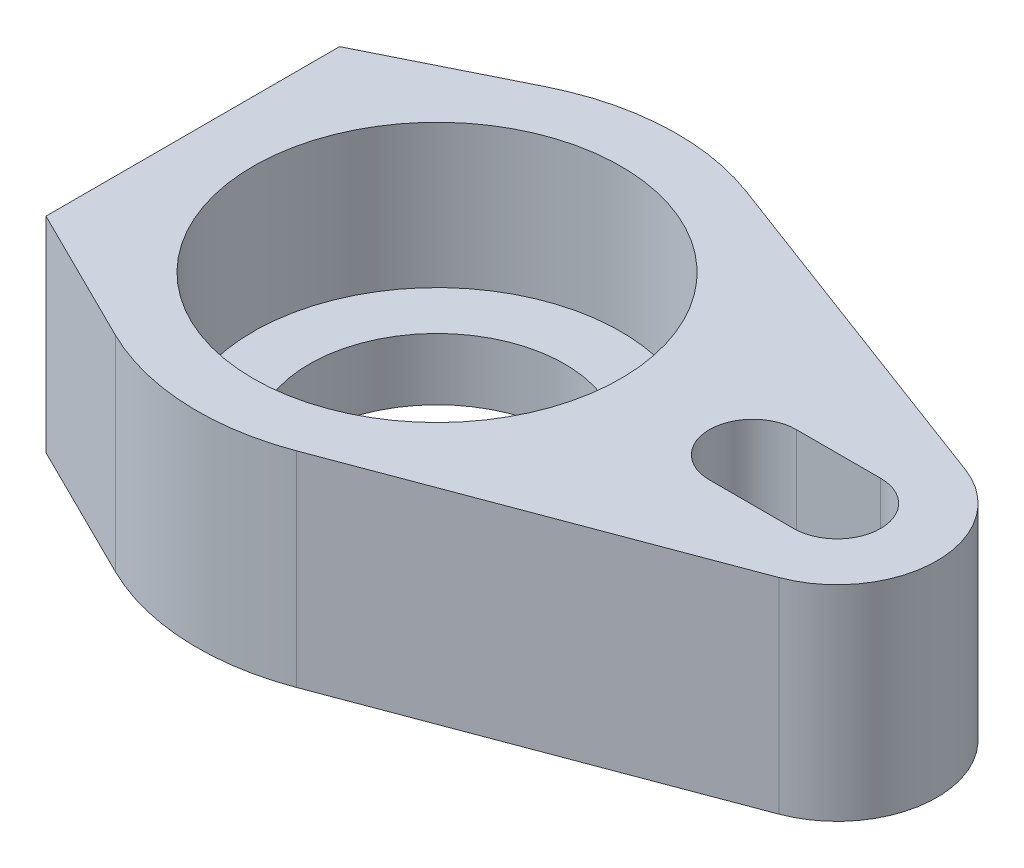
from build123d import *

# Parameters (mm, degrees)
SKETCH1_R     = 6.55
BODY_DEPTH    = 7.3
FLOOR_2_DEPTH = 2.2


with BuildPart() as part:
    # Sketch1 → Body (new body)
    with BuildSketch(Plane(origin=(0, 0, 0), x_dir=(1, 0, 0), z_dir=(0, 1, 0))):
        with BuildLine():
            Line((3, -8.006403687), (15.495614035, -3.324296268))
            ThreePointArc((15.495614035, -3.324296268), (17.8, 0), (15.495614035, 3.324296268))
            Line((15.495614035, 3.324296268), (3, 8.006403687))
            ThreePointArc((3, 8.006403687), (-0.436058681, 8.538873042), (-3.8, 7.659144861))
            Line((-3.8, 7.659144861), (-8.7, 5.228064063))
            Line((-8.7, 5.228064063), (-8.7, -5.228064063))
            Line((-8.7, -5.228064063), (-3.8, -7.659144861))
            ThreePointArc((-3.8, -7.659144861), (-0.436058681, -8.538873042), (3, -8.006403687))
        make_face()
        with Locations(Location((0, 0, 0), (0, 0, 270))):
            Circle(SKETCH1_R, mode=Mode.SUBTRACT)
        with BuildLine():
            Line((11.25, 1.55), (14.25, 1.55))
            ThreePointArc((14.25, 1.55), (15.8, 0), (14.25, -1.55))
            Line((14.25, -1.55), (11.25, -1.55))
            ThreePointArc((11.25, -1.55), (9.7, 0), (11.25, 1.55))
        make_face(mode=Mode.SUBTRACT)
    extrude(amount=BODY_DEPTH)

    # Sketch1<4> → Floor 2 (add)
    with BuildSketch(Plane(origin=(0, 0, 0), x_dir=(1, 0, 0), z_dir=(0, 1, 0))):
        with BuildLine():
            ThreePointArc((6.55, 0), (6.413226158, 1.33155182), (6.008616718, 2.607494034))
            Line((6.008616718, 2.607494034), (1.596491228, 4.260717752))
            ThreePointArc((1.596491228, 4.260717752), (3.73942075, 2.592148232), (4.55, 0))
            ThreePointArc((4.55, 0), (2.398060559, -3.866756464), (-2.022222222, -4.075919195))
            Line((-2.022222222, -4.075919195), (-6.242982203, -1.981835819))
            ThreePointArc((-6.242982203, -1.981835819), (-4.972324895, -4.263623476), (-2.911111111, -5.867532028))
            ThreePointArc((-2.911111111, -5.867532028), (-0.33405665, -6.541475839), (2.298245614, -6.133560719))
            ThreePointArc((2.298245614, -6.133560719), (5.383122178, -3.731554048), (6.55, 0))
        make_face()
        with BuildLine():
            Line((1.596491228, 4.260717752), (6.008616718, 2.607494034))
            ThreePointArc((6.008616718, 2.607494034), (4.512125554, 4.747970407), (2.298245614, 6.133560719))
            ThreePointArc((2.298245614, 6.133560719), (-0.33405665, 6.541475839), (-2.911111111, 5.867532028))
            ThreePointArc((-2.911111111, 5.867532028), (-6.029303442, 2.559296778), (-6.242982203, -1.981835819))
            Line((-6.242982203, -1.981835819), (-2.022222222, -4.075919195))
            ThreePointArc((-2.022222222, -4.075919195), (-4.173750186, 1.811714488), (1.596491228, 4.260717752))
        make_face()
    extrude(amount=FLOOR_2_DEPTH)


solid = part.part
